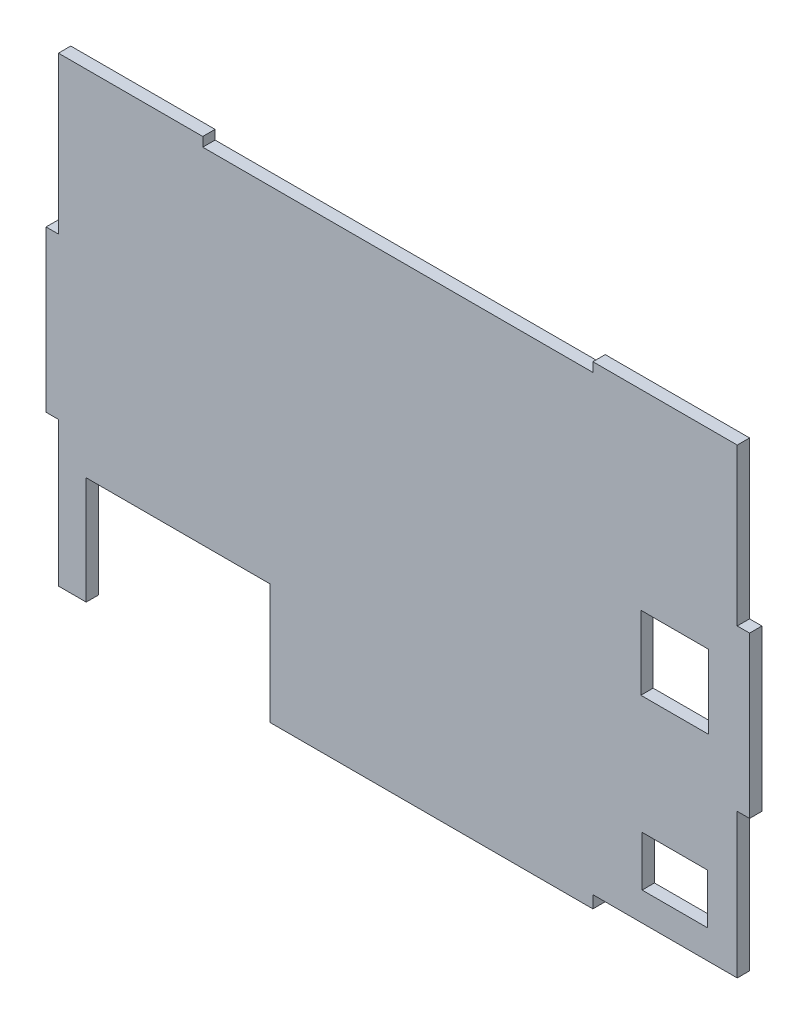
from build123d import *

# Parameters (mm, degrees)
SKETCH1_W           = 10.941421357
SKETCH1_H           = 11.941421356
SKETCH1_W_2         = 10.592806427
SKETCH1_H_2         = 8.104699542
BOSS_EXTRUDE1_DEPTH = 2


with BuildPart() as part:
    # Sketch1 → Boss-Extrude1 (new body)
    with BuildSketch(Plane.XY):
        Polygon((-17.530083786, -39.851014635), (34.848035205, -39.851014635), (34.848035205, -37.851014635), (58.248035205, -37.851014635), (58.248035205, -14.451014635), (60.248035205, -14.451014635), (60.248035205, 11.570710678), (58.248035205, 11.570710678), (58.248035205, 35.465), (58.248035205, 36.970710678), (34.848035205, 36.970710678), (34.848035205, 35.465), (-28.397964795, 35.465), (-28.397964795, 36.970710678), (-51.797964795, 36.970710678), (-51.797964795, 35.465), (-51.797964795, 11.570710678), (-53.797964795, 11.570710678), (-53.797964795, -14.451014635), (-51.797964795, -14.451014635), (-51.797964795, -37.851014635), (-47.289775284, -37.851014635), (-47.289775284, -20.394686971), (-17.530083786, -20.394686971), align=None)
        with Locations((48.088035205, 0)):
            Rectangle(SKETCH1_W, SKETCH1_H, mode=Mode.SUBTRACT)
        with Locations((48.125184252, -29.163096081)):
            Rectangle(SKETCH1_W_2, SKETCH1_H_2, mode=Mode.SUBTRACT)
    extrude(amount=BOSS_EXTRUDE1_DEPTH)


solid = part.part
